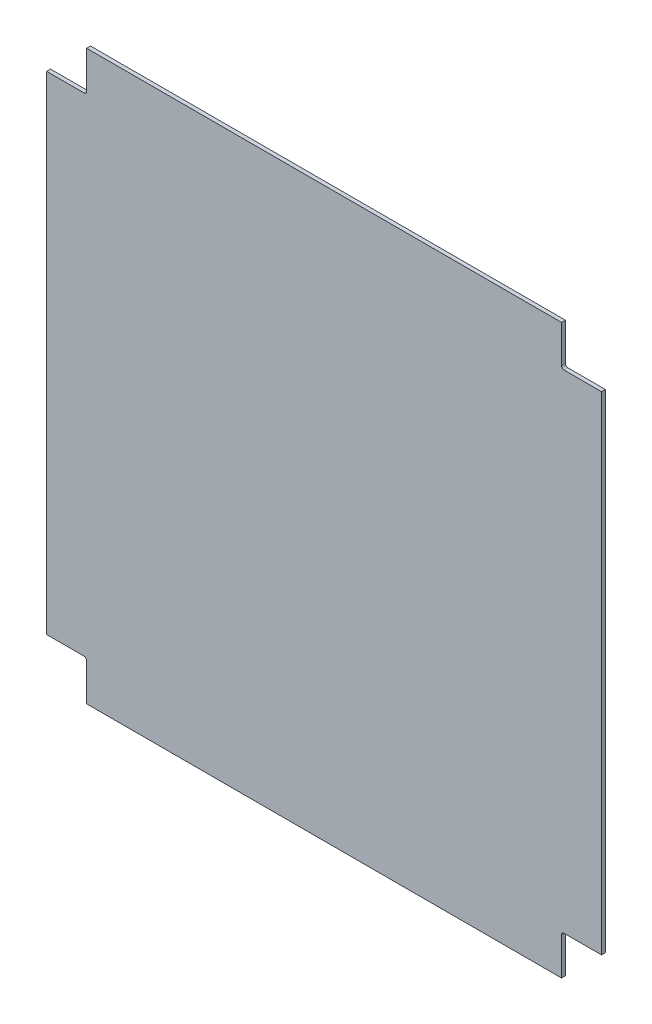
from build123d import *

# Parameters (mm, degrees)
BOSS_EXTRUDE1_DEPTH = 3


with BuildPart() as part:
    # Sketch1 → Boss-Extrude1 (new body)
    with BuildSketch(Plane.XY):
        with BuildLine():
            Line((215, -189), (215, 189))
            Line((215, 189), (186, 189))
            ThreePointArc((186, 189), (184.585786438, 189.585786438), (184, 191))
            Line((184, 191), (184, 220))
            Line((184, 220), (-184, 220))
            Line((-184, 220), (-184, 191))
            ThreePointArc((-184, 191), (-184.585786438, 189.585786438), (-186, 189))
            Line((-186, 189), (-215, 189))
            Line((-215, 189), (-215, -189))
            Line((-215, -189), (-186, -189))
            ThreePointArc((-186, -189), (-184.585786438, -189.585786438), (-184, -191))
            Line((-184, -191), (-184, -220))
            Line((-184, -220), (184, -220))
            Line((184, -220), (184, -191))
            ThreePointArc((184, -191), (184.585786438, -189.585786438), (186, -189))
            Line((186, -189), (215, -189))
        make_face()
    extrude(amount=BOSS_EXTRUDE1_DEPTH)


solid = part.part
